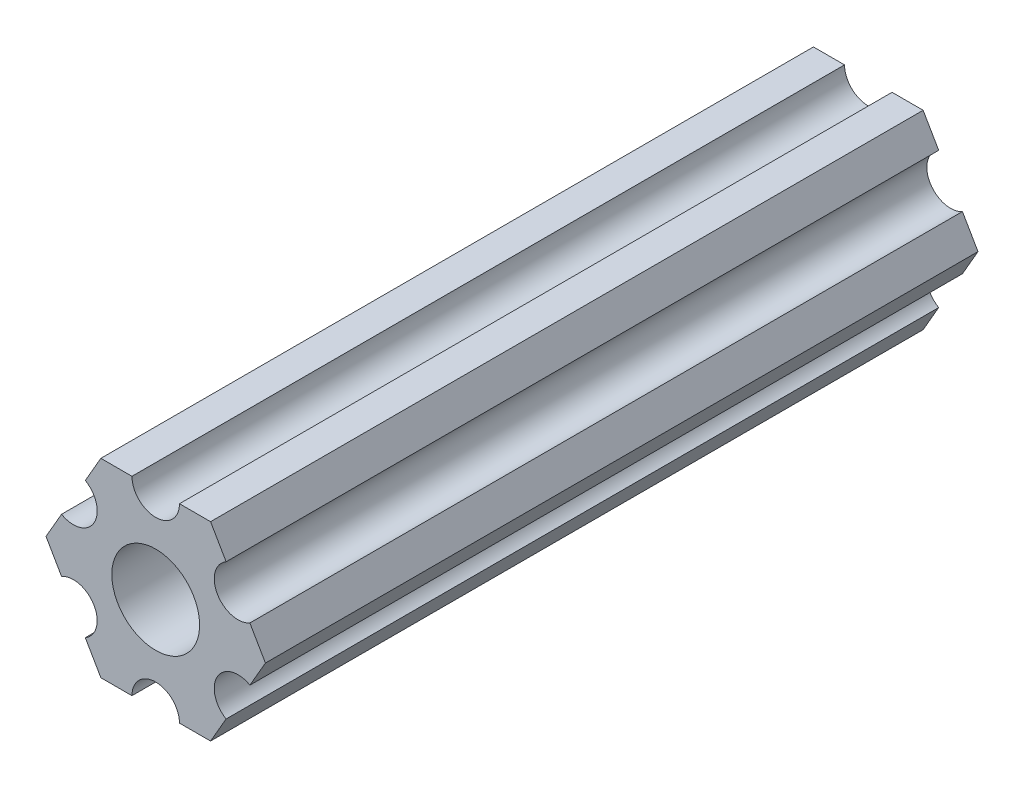
from build123d import *

# Parameters (mm, degrees)
SKETCH1_R           = 2.9337
BOSS_EXTRUDE1_DEPTH = 47.625


with BuildPart() as part:
    # Sketch1 → Boss-Extrude1 (new body)
    with BuildSketch(Plane.XY.offset(304.8)):
        with BuildLine():
            Line((6.293011699, -1.800184894), (7.332348803, -2.22e-07))
            Line((7.332348803, -2.22e-07), (6.293011439, 1.800184522))
            ThreePointArc((6.293011439, 1.800184522), (4.124446058, 2.381249653), (4.705511189, 4.549815034))
            Line((4.705511189, 4.549815034), (3.666173825, 6.349999778))
            Line((3.666173825, 6.349999778), (1.587499615, 6.349999778))
            ThreePointArc((1.587499615, 6.349999778), (-3.85e-07, 4.762499778), (-1.587500385, 6.349999778))
            Line((-1.587500385, 6.349999778), (-3.666174594, 6.349999778))
            Line((-3.666174594, 6.349999778), (-4.70551159, 4.549815043))
            ThreePointArc((-4.70551159, 4.549815043), (-4.12444613, 2.38124975), (-6.293011423, 1.80018429))
            Line((-6.293011423, 1.80018429), (-7.332348419, -4.44e-07))
            Line((-7.332348419, -4.44e-07), (-6.293011205, -1.800185053))
            ThreePointArc((-6.293011205, -1.800185053), (-4.124445841, -2.38125025), (-4.705511038, -4.549815614))
            Line((-4.705511038, -4.549815614), (-3.666173825, -6.350000222))
            Line((-3.666173825, -6.350000222), (-1.587499615, -6.350000222))
            ThreePointArc((-1.587499615, -6.350000222), (3.85e-07, -4.762500222), (1.587500385, -6.350000222))
            Line((1.587500385, -6.350000222), (3.666174594, -6.350000222))
            Line((3.666174594, -6.350000222), (4.705511699, -4.549815551))
            ThreePointArc((4.705511699, -4.549815551), (4.12444637, -2.381250222), (6.293011699, -1.800184894))
        make_face()
        with Locations(Location((0, 0, 0), (0, 0, 180))):
            Circle(SKETCH1_R, mode=Mode.SUBTRACT)
    extrude(amount=-BOSS_EXTRUDE1_DEPTH)


solid = part.part
